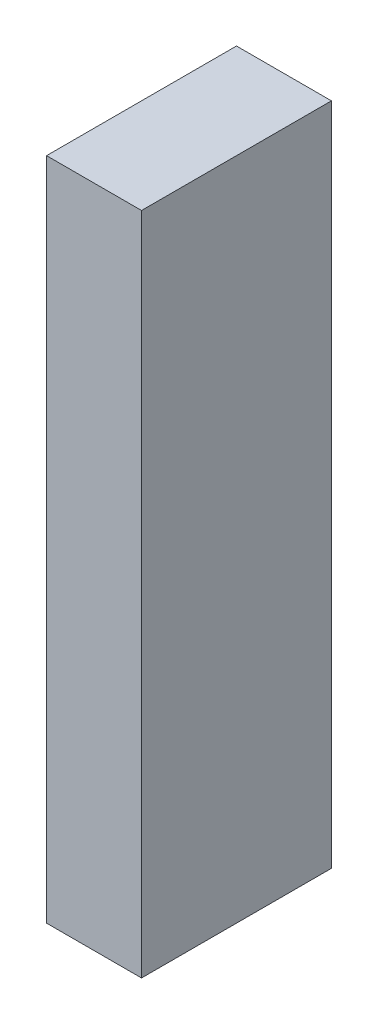
from build123d import *

# Parameters (mm, degrees)
SKETCH1_W           = 50.8
SKETCH1_H           = 101.6
BOSS_EXTRUDE1_DEPTH = 355.6


with BuildPart() as part:
    # Sketch1 → Boss-Extrude1 (new body)
    with BuildSketch(Plane(origin=(0, 0, 0), x_dir=(1, 0, 0), z_dir=(0, 1, 0))):
        Rectangle(SKETCH1_W, SKETCH1_H)
    extrude(amount=BOSS_EXTRUDE1_DEPTH)


solid = part.part
